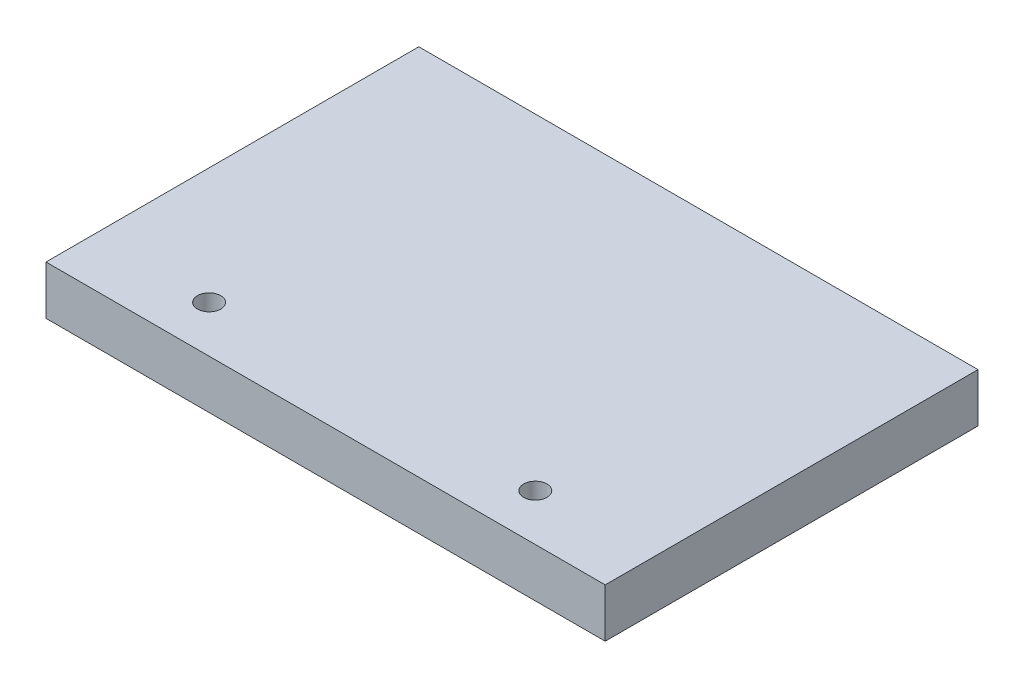
from build123d import *

# Parameters (mm, degrees)
SKETCH1_W           = 76.2
SKETCH1_H           = 50.8
BOSS_EXTRUDE1_DEPTH = 6.6548
SKETCH2_R           = 1.5875
CUT_EXTRUDE1_DEPTH  = 92.822471994


with BuildPart() as part:
    # Sketch1 → Boss-Extrude1 (new body)
    with BuildSketch(Plane(origin=(0, 0, 0), x_dir=(1, 0, 0), z_dir=(0, 1, 0))):
        with Locations((38.1, 25.4)):
            Rectangle(SKETCH1_W, SKETCH1_H)
    extrude(amount=BOSS_EXTRUDE1_DEPTH)

    # Sketch2 → Cut-Extrude1 (cut, through all)
    with BuildSketch(Plane(origin=(0, 6.6548, 0), x_dir=(1, 0, 0), z_dir=(0, 1, 0))):
        with Locations(Location((15.875, 6.35, 0), (0, 0, 270))):
            Circle(SKETCH2_R)
        with Locations(Location((60.325, 6.35, 0), (0, 0, 270))):
            Circle(SKETCH2_R)
    extrude(amount=-CUT_EXTRUDE1_DEPTH, mode=Mode.SUBTRACT)


solid = part.part
